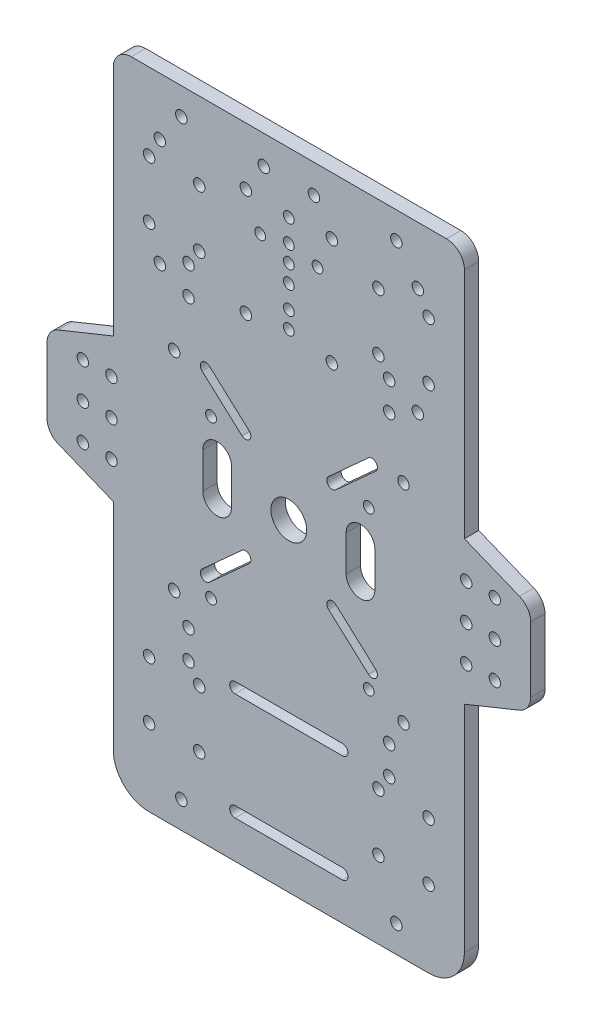
from build123d import *

# Parameters (mm, degrees)
SKETCH_1_R      = 1.6
SKETCH_1_R_2    = 5
SKETCH_1_R_3    = 1.5
EXTRUDE_1_DEPTH = 4


with BuildPart() as part:
    # 草图1 → 凸台-拉伸1 (new body)
    with BuildSketch(Plane.XY):
        with BuildLine():
            Line((-16.419786686, 79.176264565), (-1.041261143, 72.941727182))
            Line((-1.041261143, 72.941727182), (-1.041261143, 12.941727182))
            ThreePointArc((-1.041261143, 12.941727182), (1.887671046, 5.87065937), (8.958738857, 2.941727182))
            Line((8.958738857, 2.941727182), (86.958738857, 2.941727182))
            ThreePointArc((86.958738857, 2.941727182), (94.029806669, 5.87065937), (96.958738857, 12.941727182))
            Line((96.958738857, 12.941727182), (96.958738857, 72.941727182))
            Line((96.958738857, 72.941727182), (112.337264401, 79.176264565))
            ThreePointArc((112.337264401, 79.176264565), (114.605582701, 81.01645305), (115.458738857, 83.809960906))
            Line((115.458738857, 83.809960906), (115.458738857, 102.073493459))
            ThreePointArc((115.458738857, 102.073493459), (114.605582701, 104.867001314), (112.337264401, 106.7071898))
            Line((112.337264401, 106.7071898), (96.958738857, 112.941727182))
            Line((96.958738857, 112.941727182), (96.958738857, 177.941727182))
            ThreePointArc((96.958738857, 177.941727182), (95.494272763, 181.477261088), (91.958738857, 182.941727182))
            Line((91.958738857, 182.941727182), (3.958738857, 182.941727182))
            ThreePointArc((3.958738857, 182.941727182), (0.423204952, 181.477261088), (-1.041261143, 177.941727182))
            Line((-1.041261143, 177.941727182), (-1.041261143, 112.941727182))
            Line((-1.041261143, 112.941727182), (-16.419786686, 106.7071898))
            ThreePointArc((-16.419786686, 106.7071898), (-18.688104986, 104.867001314), (-19.541261143, 102.073493459))
            Line((-19.541261143, 102.073493459), (-19.541261143, 83.809960906))
            ThreePointArc((-19.541261143, 83.809960906), (-18.688104986, 81.01645305), (-16.419786686, 79.176264565))
        make_face()
        with Locations((22.958738857, 161.441727182)):
            Circle(SKETCH_1_R, mode=Mode.SUBTRACT)
        with Locations((72.958738857, 145.441727182)):
            Circle(SKETCH_1_R, mode=Mode.SUBTRACT)
        with Locations((72.958738857, 24.441727182)):
            Circle(SKETCH_1_R, mode=Mode.SUBTRACT)
        with Locations((72.958738857, 40.441727182)):
            Circle(SKETCH_1_R, mode=Mode.SUBTRACT)
        with Locations((86.958738857, 40.441727182)):
            Circle(SKETCH_1_R, mode=Mode.SUBTRACT)
        with Locations((86.958738857, 145.441727182)):
            Circle(SKETCH_1_R, mode=Mode.SUBTRACT)
        with Locations((86.958738857, 161.441727182)):
            Circle(SKETCH_1_R, mode=Mode.SUBTRACT)
        with Locations((72.958738857, 161.441727182)):
            Circle(SKETCH_1_R, mode=Mode.SUBTRACT)
        with Locations((22.958738857, 40.441727182)):
            Circle(SKETCH_1_R, mode=Mode.SUBTRACT)
        with Locations((8.958738857, 145.441727182)):
            Circle(SKETCH_1_R, mode=Mode.SUBTRACT)
        with Locations((8.958738857, 161.441727182)):
            Circle(SKETCH_1_R, mode=Mode.SUBTRACT)
        with Locations((22.958738857, 145.441727182)):
            Circle(SKETCH_1_R, mode=Mode.SUBTRACT)
        with Locations((86.958738857, 24.441727182)):
            Circle(SKETCH_1_R, mode=Mode.SUBTRACT)
        with Locations((8.958738857, 24.441727182)):
            Circle(SKETCH_1_R, mode=Mode.SUBTRACT)
        with Locations((8.958738857, 40.441727182)):
            Circle(SKETCH_1_R, mode=Mode.SUBTRACT)
        with Locations((22.958738857, 24.441727182)):
            Circle(SKETCH_1_R, mode=Mode.SUBTRACT)
        with Locations((40.958738857, 174.941727182)):
            Circle(SKETCH_1_R, mode=Mode.SUBTRACT)
        with Locations((75.958738857, 140.941727182)):
            Circle(SKETCH_1_R, mode=Mode.SUBTRACT)
        with Locations((54.958738857, 174.941727182)):
            Circle(SKETCH_1_R, mode=Mode.SUBTRACT)
        with Locations((19.958738857, 52.941727182)):
            Circle(SKETCH_1_R, mode=Mode.SUBTRACT)
        with Locations((19.958738857, 44.941727182)):
            Circle(SKETCH_1_R, mode=Mode.SUBTRACT)
        with Locations((75.958738857, 44.941727182)):
            Circle(SKETCH_1_R, mode=Mode.SUBTRACT)
        with Locations((75.958738857, 132.941727182)):
            Circle(SKETCH_1_R, mode=Mode.SUBTRACT)
        with Locations((19.958738857, 132.941727182)):
            Circle(SKETCH_1_R, mode=Mode.SUBTRACT)
        with Locations((19.958738857, 140.941727182)):
            Circle(SKETCH_1_R, mode=Mode.SUBTRACT)
        with Locations((75.958738857, 52.941727182)):
            Circle(SKETCH_1_R, mode=Mode.SUBTRACT)
        with Locations((35.958738857, 136.941727182)):
            Circle(SKETCH_1_R, mode=Mode.SUBTRACT)
        with Locations((97.458738857, 82.941727182)):
            Circle(SKETCH_1_R, mode=Mode.SUBTRACT)
        with Locations((105.458738857, 82.941727182)):
            Circle(SKETCH_1_R, mode=Mode.SUBTRACT)
        with Locations((97.458738857, 92.941727182)):
            Circle(SKETCH_1_R, mode=Mode.SUBTRACT)
        with Locations((105.458738857, 92.941727182)):
            Circle(SKETCH_1_R, mode=Mode.SUBTRACT)
        with Locations((-9.541261143, 82.941727182)):
            Circle(SKETCH_1_R, mode=Mode.SUBTRACT)
        with Locations((-1.541261143, 82.941727182)):
            Circle(SKETCH_1_R, mode=Mode.SUBTRACT)
        with Locations((-1.541261143, 92.941727182)):
            Circle(SKETCH_1_R, mode=Mode.SUBTRACT)
        with Locations((-9.541261143, 92.941727182)):
            Circle(SKETCH_1_R, mode=Mode.SUBTRACT)
        with Locations((-1.541261143, 102.941727182)):
            Circle(SKETCH_1_R, mode=Mode.SUBTRACT)
        with Locations((-9.541261143, 102.941727182)):
            Circle(SKETCH_1_R, mode=Mode.SUBTRACT)
        with Locations((83.958738857, 136.941727182)):
            Circle(SKETCH_1_R, mode=Mode.SUBTRACT)
        with Locations((59.958738857, 136.941727182)):
            Circle(SKETCH_1_R, mode=Mode.SUBTRACT)
        with Locations((59.958738857, 166.941727182)):
            Circle(SKETCH_1_R, mode=Mode.SUBTRACT)
        with Locations((15.958738857, 117.941727182)):
            Circle(SKETCH_1_R, mode=Mode.SUBTRACT)
        with Locations((35.958738857, 166.941727182)):
            Circle(SKETCH_1_R, mode=Mode.SUBTRACT)
        with Locations((11.958738857, 136.941727182)):
            Circle(SKETCH_1_R, mode=Mode.SUBTRACT)
        with Locations((11.958738857, 166.941727182)):
            Circle(SKETCH_1_R, mode=Mode.SUBTRACT)
        with Locations((83.958738857, 166.941727182)):
            Circle(SKETCH_1_R, mode=Mode.SUBTRACT)
        with Locations((105.458738857, 102.941727182)):
            Circle(SKETCH_1_R, mode=Mode.SUBTRACT)
        with Locations((97.458738857, 102.941727182)):
            Circle(SKETCH_1_R, mode=Mode.SUBTRACT)
        with Locations((47.958738857, 92.941727182)):
            Circle(SKETCH_1_R_2, mode=Mode.SUBTRACT)
        with Locations((79.958738857, 117.941727182)):
            Circle(SKETCH_1_R, mode=Mode.SUBTRACT)
        with Locations((79.958738857, 59.941727182)):
            Circle(SKETCH_1_R, mode=Mode.SUBTRACT)
        with Locations((15.958738857, 59.941727182)):
            Circle(SKETCH_1_R, mode=Mode.SUBTRACT)
        with Locations((77.958738857, 175.441727182)):
            Circle(SKETCH_1_R, mode=Mode.SUBTRACT)
        with Locations((17.958738857, 175.441727182)):
            Circle(SKETCH_1_R, mode=Mode.SUBTRACT)
        with Locations((17.958738857, 10.441727182)):
            Circle(SKETCH_1_R, mode=Mode.SUBTRACT)
        with Locations((77.958738857, 10.441727182)):
            Circle(SKETCH_1_R, mode=Mode.SUBTRACT)
        with Locations((26.246162591, 107.185151506)):
            Circle(SKETCH_1_R_3, mode=Mode.SUBTRACT)
        with Locations((26.246162591, 63.185151506)):
            Circle(SKETCH_1_R_3, mode=Mode.SUBTRACT)
        with Locations((70.246162591, 63.185151506)):
            Circle(SKETCH_1_R_3, mode=Mode.SUBTRACT)
        with Locations((70.246162591, 107.185151506)):
            Circle(SKETCH_1_R_3, mode=Mode.SUBTRACT)
        with Locations((47.960174004, 166.120088822)):
            Circle(SKETCH_1_R_3, mode=Mode.SUBTRACT)
        with Locations((47.960174004, 150.120088822)):
            Circle(SKETCH_1_R_3, mode=Mode.SUBTRACT)
        with Locations((39.960174004, 158.120088822)):
            Circle(SKETCH_1_R_3, mode=Mode.SUBTRACT)
        with Locations((55.960174004, 158.120088822)):
            Circle(SKETCH_1_R_3, mode=Mode.SUBTRACT)
        with Locations((47.960174004, 159.79228367)):
            Circle(SKETCH_1_R_3, mode=Mode.SUBTRACT)
        with Locations((47.960174004, 143.79228367)):
            Circle(SKETCH_1_R_3, mode=Mode.SUBTRACT)
        with Locations((47.960174004, 155.046429946)):
            Circle(SKETCH_1_R_3, mode=Mode.SUBTRACT)
        with Locations((47.960174004, 139.046429946)):
            Circle(SKETCH_1_R_3, mode=Mode.SUBTRACT)
        with BuildLine():
            Line((71.958738857, 87.941727182), (71.958738857, 97.941727182))
            ThreePointArc((71.958738857, 97.941727182), (67.958738857, 101.941727182), (63.958738857, 97.941727182))
            Line((63.958738857, 97.941727182), (63.958738857, 87.941727182))
            ThreePointArc((63.958738857, 87.941727182), (67.958738857, 83.941727182), (71.958738857, 87.941727182))
        make_face(mode=Mode.SUBTRACT)
        with BuildLine():
            Line((31.958738857, 87.941727182), (31.958738857, 97.941727182))
            ThreePointArc((31.958738857, 97.941727182), (27.958738857, 101.941727182), (23.958738857, 97.941727182))
            Line((23.958738857, 97.941727182), (23.958738857, 87.941727182))
            ThreePointArc((23.958738857, 87.941727182), (27.958738857, 83.941727182), (31.958738857, 87.941727182))
        make_face(mode=Mode.SUBTRACT)
        with BuildLine():
            Line((61.063788273, 106.79385107), (72.178592544, 116.866642441))
            ThreePointArc((72.178592544, 116.866642441), (72.282793834, 118.985402005), (70.16403427, 119.089603295))
            Line((70.16403427, 119.089603295), (59.049229998, 109.016811924))
            ThreePointArc((59.049229998, 109.016811924), (58.945028708, 106.89805236), (61.063788273, 106.79385107))
        make_face(mode=Mode.SUBTRACT)
        with BuildLine():
            Line((36.868247717, 109.016811924), (25.753443445, 119.089603295))
            ThreePointArc((25.753443445, 119.089603295), (23.634683881, 118.985402005), (23.738885171, 116.866642441))
            Line((23.738885171, 116.866642441), (34.853689442, 106.79385107))
            ThreePointArc((34.853689442, 106.79385107), (36.972449007, 106.89805236), (36.868247717, 109.016811924))
        make_face(mode=Mode.SUBTRACT)
        with BuildLine():
            Line((34.853689442, 79.089603295), (23.738885171, 69.016811924))
            ThreePointArc((23.738885171, 69.016811924), (23.634683881, 66.89805236), (25.753443445, 66.79385107))
            Line((25.753443445, 66.79385107), (36.868247717, 76.866642441))
            ThreePointArc((36.868247717, 76.866642441), (36.972449007, 78.985402005), (34.853689442, 79.089603295))
        make_face(mode=Mode.SUBTRACT)
        with BuildLine():
            Line((59.049229998, 76.866642441), (70.16403427, 66.79385107))
            ThreePointArc((70.16403427, 66.79385107), (72.282793834, 66.89805236), (72.178592544, 69.016811924))
            Line((72.178592544, 69.016811924), (61.063788273, 79.089603295))
            ThreePointArc((61.063788273, 79.089603295), (58.945028708, 78.985402005), (59.049229998, 76.866642441))
        make_face(mode=Mode.SUBTRACT)
        with BuildLine():
            Line((32.958738857, 43.441727182), (62.958738857, 43.441727182))
            ThreePointArc((62.958738857, 43.441727182), (64.458738857, 44.941727182), (62.958738857, 46.441727182))
            Line((62.958738857, 46.441727182), (32.958738857, 46.441727182))
            ThreePointArc((32.958738857, 46.441727182), (31.458738857, 44.941727182), (32.958738857, 43.441727182))
        make_face(mode=Mode.SUBTRACT)
        with BuildLine():
            Line((32.958738857, 13.441727182), (62.958738857, 13.441727182))
            ThreePointArc((62.958738857, 13.441727182), (64.458738857, 14.941727182), (62.958738857, 16.441727182))
            Line((62.958738857, 16.441727182), (32.958738857, 16.441727182))
            ThreePointArc((32.958738857, 16.441727182), (31.458738857, 14.941727182), (32.958738857, 13.441727182))
        make_face(mode=Mode.SUBTRACT)
    extrude(amount=EXTRUDE_1_DEPTH)


solid = part.part
